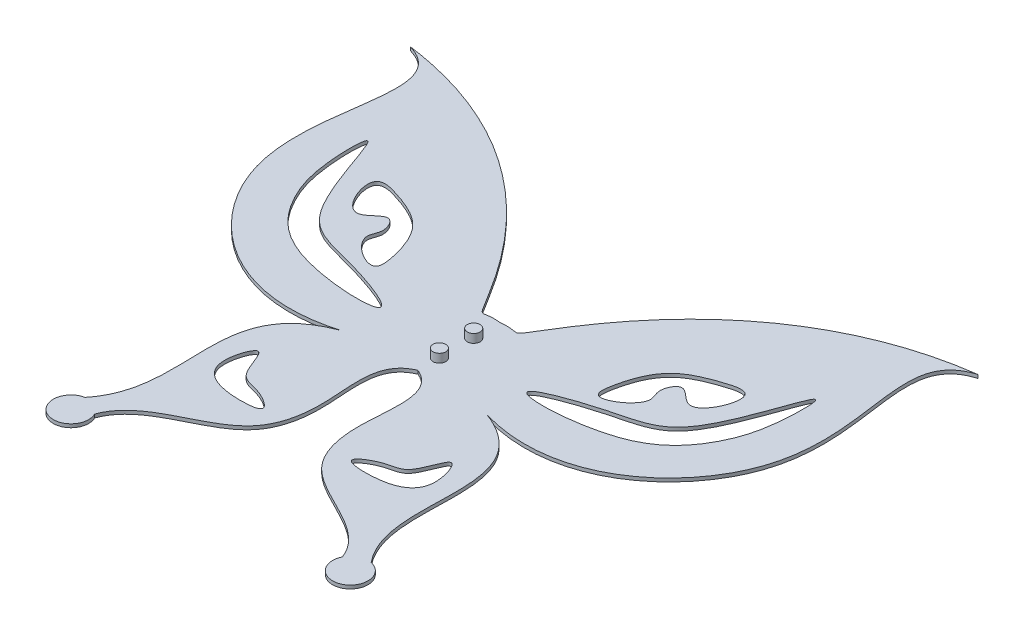
from build123d import *

# Parameters (mm, degrees)
BOSS_EXTRUDE3_DEPTH = 0.8
HARNESS_R           = 1.5
BOSS_EXTRUDE4_DEPTH = 2


with BuildPart() as part:
    # Sketch1 → Boss-Extrude3 (new body)
    with BuildSketch(Plane(origin=(0, 0, 0), x_dir=(1, 0, 0), z_dir=(0, 1, 0))):
        with BuildLine():
            ThreePointArc((28.888039942, -65.77219443), (34.415921768, -71.307257008), (33.396235087, -63.551315138))
            add(Edge.make_bspline(
                [(17.168845941, -20.199510482), (25.601862346, -23.416880713), (31.930259846, -36.821733843), (26.579691655, -55.234951459), (33.396235087, -63.551315138)],
                knots=[0.041703536, 0.041703536, 0.041703536, 0.041703536, 0.4221791, 1, 1, 1, 1], degree=3))
            add(Edge.make_bspline(
                [(66.199286602, 45.271770192), (51.616651545, 40.882704411), (68.622943428, 18.083336745), (51.220574163, -15.295108956), (34.277659956, -25.115855404), (17.168845941, -20.199510482)],
                knots=[0, 0, 0, 0, 0.577712186, 0.654586081, 0.981175092, 0.981175092, 0.981175092, 0.981175092], degree=3))
            add(Edge.make_bspline(
                [(66.199286602, 45.271770192), (25.188769317, 39.760052824), (2.821146187, -5.288592208), (3.975078037, 0.46270426), (0, 0)],
                knots=[0, 0, 0, 0, 0.746463146, 1, 1, 1, 1], degree=3))
            add(Edge.make_bspline(
                [(-66.199286602, 45.271770192), (-25.188769317, 39.760052824), (-2.821146187, -5.288592208), (-3.975078037, 0.46270426), (0, 0)],
                knots=[0, 0, 0, 0, 0.746463146, 1, 1, 1, 1], degree=3))
            add(Edge.make_bspline(
                [(-66.199286602, 45.271770192), (-51.616651674, 40.882704374), (-68.622943119, 18.083336884), (-51.22057473, -15.295108333), (-34.277658731, -25.11585374), (-17.168845941, -20.199510483)],
                knots=[0, 0, 0, 0, 0.577712186, 0.65458608, 0.981175074, 0.981175074, 0.981175074, 0.981175074], degree=3))
            add(Edge.make_bspline(
                [(-17.168845941, -20.199510483), (-25.601864563, -23.416880605), (-31.930257486, -36.821732055), (-26.579693148, -55.234952029), (-33.396235087, -63.551315138)],
                knots=[0.041703494, 0.041703494, 0.041703494, 0.041703494, 0.4221791, 1, 1, 1, 1], degree=3))
            ThreePointArc((-33.396235087, -63.551315138), (-34.415921768, -71.307257008), (-28.888039942, -65.77219443))
            add(Edge.make_bspline(
                [(0, -19.219147723), (-6.762904012, -22.065254633), (-2.943032564, -35.244592356), (-7.26629122, -55.518667737), (-25.66010738, -57.01623645), (-28.888039942, -65.77219443)],
                knots=[0, 0, 0, 0, 0.333932779, 0.545148811, 1, 1, 1, 1], degree=3))
            add(Edge.make_bspline(
                [(0, -19.219147723), (6.762904012, -22.065254633), (2.943032564, -35.244592356), (7.26629122, -55.518667737), (25.66010738, -57.01623645), (28.888039942, -65.77219443)],
                knots=[0, 0, 0, 0, 0.333932779, 0.545148811, 1, 1, 1, 1], degree=3))
        make_face()
        with BuildLine():
            add(Edge.make_bspline(
                [(30.010736325, -5.371520279), (35.646907205, -3.838791271), (45.900543118, -2.617869588), (53.230925245, 31.353295803), (52.809655123, 9.479192824), (48.846591649, -0.828614969), (39.564852657, -11.830029321), (7.468807558, -12.917619007), (24.594755404, -6.844369708), (30.010736325, -5.371520279)],
                knots=[0, 0, 0, 0, 0.13500608, 0.342905007, 0.450287098, 0.532586262, 0.677659805, 0.870268243, 1, 1, 1, 1], degree=3))
        make_face(mode=Mode.SUBTRACT)
        with BuildLine():
            add(Edge.make_bspline(
                [(-30.010736325, -5.371520279), (-35.646907205, -3.838791271), (-45.900543118, -2.617869588), (-53.230925245, 31.353295803), (-52.809655123, 9.479192824), (-48.846591649, -0.828614969), (-39.564852657, -11.830029321), (-7.468807558, -12.917619007), (-24.594755404, -6.844369708), (-30.010736325, -5.371520279)],
                knots=[0, 0, 0, 0, 0.13500608, 0.342905007, 0.450287098, 0.532586262, 0.677659805, 0.870268243, 1, 1, 1, 1], degree=3))
        make_face(mode=Mode.SUBTRACT)
        with BuildLine():
            add(Edge.make_bspline(
                [(25.933769111, 0.943425663), (26.771837307, 4.722456666), (29.132020256, 10.141048482), (35.871012248, 13.336012136), (46.350131757, 16.351937147), (39.97561187, 0.96729674), (34.298545578, 10.1926892), (31.630456833, 4.792653024), (34.898046165, 0.397438589), (24.683183656, -6.224983722), (25.580871101, -0.647867891), (25.933769111, 0.943425663)],
                knots=[0, 0, 0, 0, 0.165088983, 0.316757052, 0.408386398, 0.575943353, 0.666415796, 0.729985495, 0.779792193, 0.930483493, 1, 1, 1, 1], degree=3))
        make_face(mode=Mode.SUBTRACT)
        with BuildLine():
            add(Edge.make_bspline(
                [(-25.933769111, 0.943425663), (-26.771837307, 4.722456666), (-29.132020256, 10.141048482), (-35.871012248, 13.336012136), (-46.350131757, 16.351937147), (-39.97561187, 0.96729674), (-34.298545578, 10.1926892), (-31.630456833, 4.792653024), (-34.898046165, 0.397438589), (-24.683183656, -6.224983722), (-25.580871101, -0.647867891), (-25.933769111, 0.943425663)],
                knots=[0, 0, 0, 0, 0.165088983, 0.316757052, 0.408386398, 0.575943353, 0.666415796, 0.729985495, 0.779792193, 0.930483493, 1, 1, 1, 1], degree=3))
        make_face(mode=Mode.SUBTRACT)
        with BuildLine():
            add(Edge.make_bspline(
                [(10.41849174, -45.012785611), (10.473196702, -45.922500287), (18.759192635, -46.545678991), (26.658175754, -43.324858901), (22.130580196, -30.030186363), (20.137955635, -41.588823489), (14.743909096, -41.448073399), (10.369120428, -44.191766712), (10.41849174, -45.012785611)],
                knots=[0, 0, 0, 0, 0.139257972, 0.407258524, 0.568049583, 0.751640501, 0.874319466, 1, 1, 1, 1], degree=3))
        make_face(mode=Mode.SUBTRACT)
        with BuildLine():
            add(Edge.make_bspline(
                [(-10.41849174, -45.012785611), (-10.473196702, -45.922500287), (-18.759192635, -46.545678991), (-26.658175754, -43.324858901), (-22.130580196, -30.030186363), (-20.137955635, -41.588823489), (-14.743909096, -41.448073399), (-10.369120428, -44.191766712), (-10.41849174, -45.012785611)],
                knots=[0, 0, 0, 0, 0.139257972, 0.407258524, 0.568049583, 0.751640501, 0.874319466, 1, 1, 1, 1], degree=3))
        make_face(mode=Mode.SUBTRACT)
    extrude(amount=BOSS_EXTRUDE3_DEPTH)

    # Harness → Boss-Extrude4 (add)
    with BuildSketch(Plane(origin=(0, 0.8, 0), x_dir=(1, 0, 0), z_dir=(0, 1, 0))):
        with Locations(Location((0, -6.219147723, 0), (0, 0, 90))):
            Circle(HARNESS_R)
        with Locations(Location((0, -14.219147723, 0), (0, 0, 90))):
            Circle(HARNESS_R)
    extrude(amount=BOSS_EXTRUDE4_DEPTH)


solid = part.part
